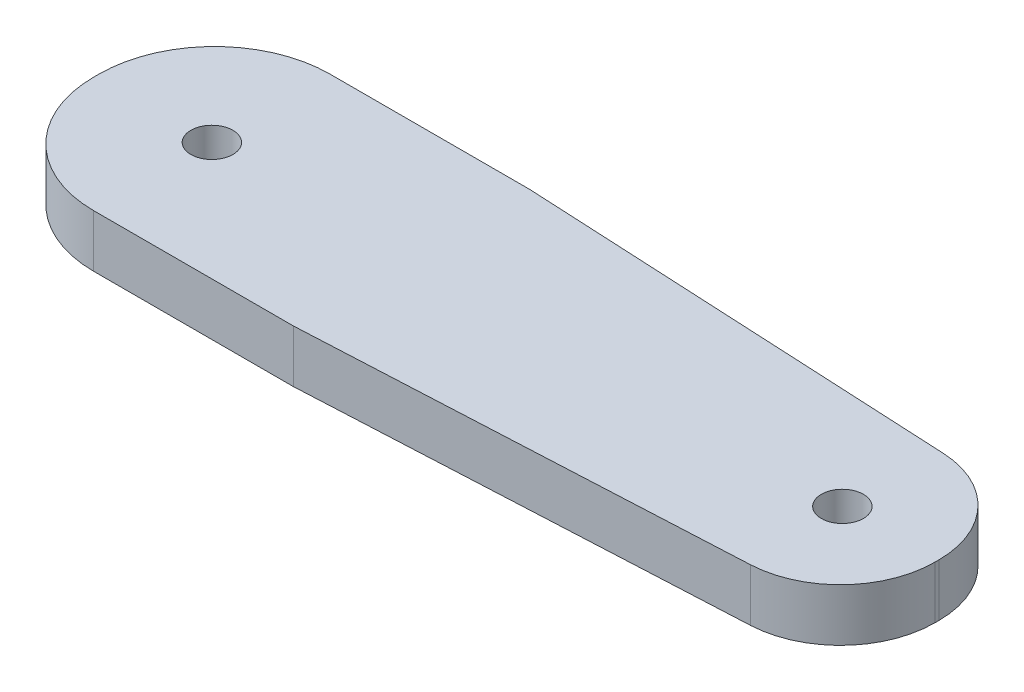
from build123d import *

# Parameters (mm, degrees)
SKETCH1_W           = 190
SKETCH1_H           = 45
BOSS_EXTRUDE1_DEPTH = 10
SKETCH2_R           = 4
CUT_EXTRUDE1_DEPTH  = 10
SKETCH3_W           = 30
SKETCH3_H           = 45
CUT_EXTRUDE2_DEPTH  = 10
FILLET1_R           = 18
FILLET2_R           = 22


with BuildPart() as part:
    # Sketch1 → Boss-Extrude1 (new body)
    with BuildSketch(Plane(origin=(0, 0, 0), x_dir=(1, 0, 0), z_dir=(0, 1, 0))):
        Rectangle(SKETCH1_W, SKETCH1_H)
    extrude(amount=BOSS_EXTRUDE1_DEPTH)

    # Sketch2 → Cut-Extrude1 (cut)
    with BuildSketch(Plane(origin=(0, 10, 0), x_dir=(1, 0, 0), z_dir=(0, 1, 0))):
        with Locations(Location((-43, 0, 0), (0, 0, 270))):
            Circle(SKETCH2_R)
        with Locations(Location((77, 0, 0), (0, 0, 270))):
            Circle(SKETCH2_R)
    extrude(amount=-CUT_EXTRUDE1_DEPTH, mode=Mode.SUBTRACT)

    # Sketch3 → Cut-Extrude2 (cut)
    with BuildSketch(Plane(origin=(0, 10, 0), x_dir=(1, 0, 0), z_dir=(0, 1, 0))):
        Polygon((95, -22.5), (-5, -22.5), (95, -17.5), align=None)
        Polygon((-5, 22.5), (95, 17.5), (95, 22.5), align=None)
        with Locations((-80, 0)):
            Rectangle(SKETCH3_W, SKETCH3_H)
    extrude(amount=-CUT_EXTRUDE2_DEPTH, mode=Mode.SUBTRACT)

    # Fillet1
    fillet1_edges = [part.edges().sort_by_distance(p)[0] for p in [
        (95, 5, -17.5),
        (95, 5, 17.5),
    ]]
    fillet(fillet1_edges, radius=FILLET1_R)

    # Fillet2
    fillet2_edges = [part.edges().sort_by_distance(p)[0] for p in [
        (-65, 5, -22.5),
        (-65, 5, 22.5),
    ]]
    fillet(fillet2_edges, radius=FILLET2_R)


solid = part.part
